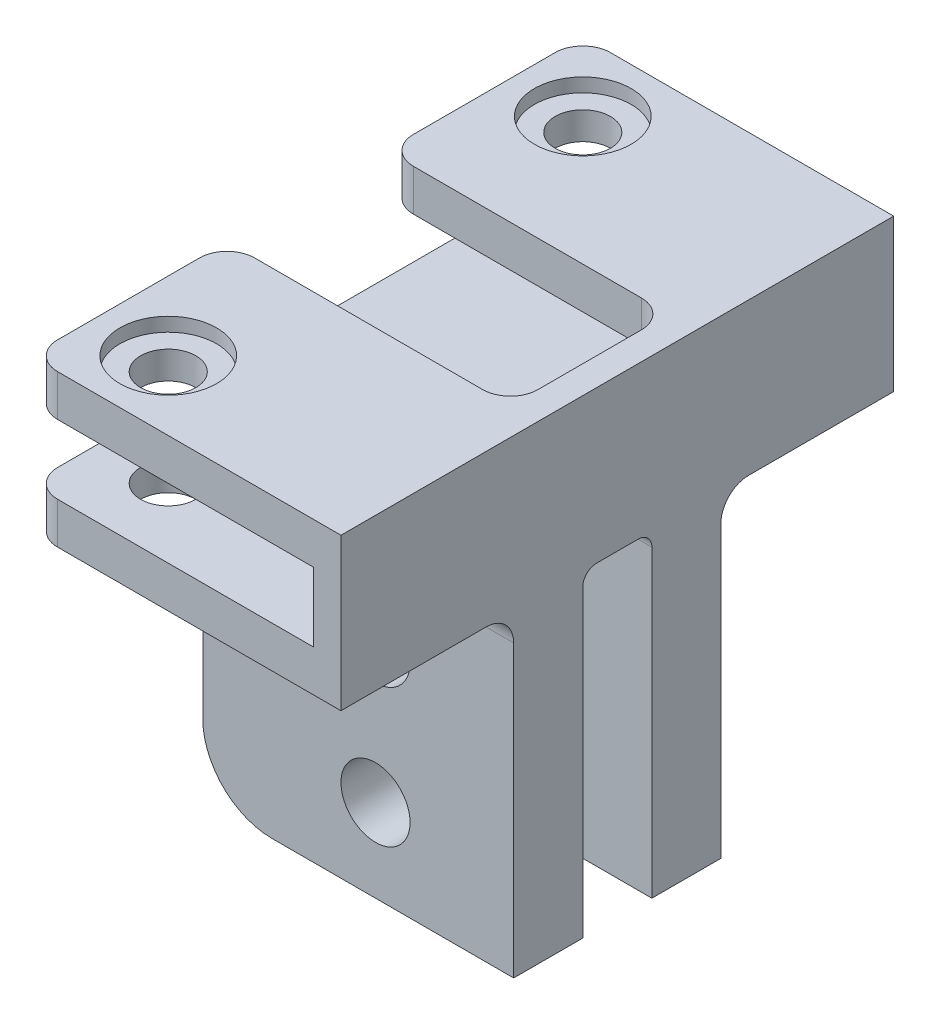
from build123d import *

# Parameters (mm, degrees)
SKETCH2_W            = 10
SKETCH2_H            = 21
SKETCH2_R            = 2.5
BOSS_EXTRUDE1_DEPTH  = 5
BOSS_EXTRUDE3_START  = 5
SKETCH3_W            = 10
SKETCH3_H            = 21
SKETCH3_R            = 2.5
BOSS_EXTRUDE3_DEPTH  = 5
SKETCH4_W            = 10
SKETCH4_H            = 5
BOSS_EXTRUDE4_DEPTH  = 2
SKETCH5_W            = 10
SKETCH5_H            = 5
BOSS_EXTRUDE5_DEPTH  = 2
BOSS_EXTRUDE6_DEPTH  = 3
FILLET1_R            = 1
FILLET2_R            = 2
BOSS_EXTRUDE7_DEPTH  = 5
SKETCH9_W            = 2
SKETCH9_H            = 40
BOSS_EXTRUDE8_DEPTH  = 5
SKETCH10_W           = 15
SKETCH10_H           = 40
BOSS_EXTRUDE9_DEPTH  = 3
CUT_EXTRUDE1_DEPTH   = 3
SKETCH13_W           = 14.256248666
SKETCH13_H           = 3
BOSS_EXTRUDE10_DEPTH = 7.5
SKETCH14_R           = 2
CUT_EXTRUDE2_DEPTH   = 44.44249072
SKETCH15_R           = 3.5
CUT_EXTRUDE3_DEPTH   = 1
CUT_EXTRUDE4_DEPTH   = 1
CUT_EXTRUDE5_DEPTH   = 1
FILLET3_R            = 5
FILLET4_R            = 2
FILLET5_R            = 2


with BuildPart() as part:
    # Sketch2 → Boss-Extrude1 (new body)
    with BuildSketch(Plane.XY):
        with Locations((5, 41.5)):
            Rectangle(SKETCH2_W, SKETCH2_H)
        with Locations((5, 47)):
            Circle(SKETCH2_R, mode=Mode.SUBTRACT)
        with Locations((5, 37)):
            Circle(SKETCH2_R, mode=Mode.SUBTRACT)
    extrude(amount=BOSS_EXTRUDE1_DEPTH)

    # Sketch4 → Boss-Extrude4 (add)
    with BuildSketch(Plane(origin=(0, 52, 0), x_dir=(1, 0, 0), z_dir=(0, 1, 0))):
        with Locations((5, -2.5)):
            Rectangle(SKETCH4_W, SKETCH4_H)
    extrude(amount=BOSS_EXTRUDE4_DEPTH)



with BuildPart() as body_2:
    # Sketch3 → Boss-Extrude3 (new body)
    with BuildSketch(Plane(origin=(0, 0, 0), x_dir=(-1, 0, 0), z_dir=(0, 0, -1)).offset(BOSS_EXTRUDE3_START)):
        with Locations((-5, 41.5)):
            Rectangle(SKETCH3_W, SKETCH3_H)
        with Locations(Location((-5, 37, 0), (0, 0, 180))):
            Circle(SKETCH3_R, mode=Mode.SUBTRACT)
        with Locations(Location((-5, 47, 0), (0, 0, 180))):
            Circle(SKETCH3_R, mode=Mode.SUBTRACT)
    extrude(amount=BOSS_EXTRUDE3_DEPTH)

    # Sketch5 → Boss-Extrude5 (add)
    with BuildSketch(Plane(origin=(0, 52, 0), x_dir=(1, 0, 0), z_dir=(0, 1, 0))):
        with Locations((5, 7.5)):
            Rectangle(SKETCH5_W, SKETCH5_H)
    extrude(amount=BOSS_EXTRUDE5_DEPTH)


with BuildPart() as part_1:
    add(part.part)

    add(body_2.part)  # Boss-Extrude6 merges body 2
    # Sketch6 → Boss-Extrude6 (add)
    with BuildSketch(Plane(origin=(0, 54, 0), x_dir=(1, 0, 0), z_dir=(0, 1, 0))):
        Polygon((10, -5), (10, -17.5), (0, -17.5), (0, -5), (0, 10), (0, 22.5), (10, 22.5), (10, 10), align=None)
    extrude(amount=BOSS_EXTRUDE6_DEPTH)

    # Fillet1
    fillet1_edges = [part_1.edges().sort_by_distance(p)[0] for p in [
        (5, 54, 0),
        (5, 54, -5),
    ]]
    fillet(fillet1_edges, radius=FILLET1_R)

    # Fillet2
    fillet2_edges = [part_1.edges().sort_by_distance(p)[0] for p in [
        (5, 54, 5),
        (5, 54, -10),
    ]]
    fillet(fillet2_edges, radius=FILLET2_R)

    # Sketch8 → Boss-Extrude7 (add)
    with BuildSketch(Plane(origin=(10, 0, 0), x_dir=(0, 0, -1), z_dir=(1, 0, 0))):
        with BuildLine():
            Line((0, 31), (0, 53))
            ThreePointArc((0, 53), (0.292893219, 53.707106781), (1, 54))
            Line((1, 54), (4, 54))
            ThreePointArc((4, 54), (4.707106781, 53.707106781), (5, 53))
            Line((5, 53), (5, 31))
            Line((5, 31), (10, 31))
            Line((10, 31), (10, 52))
            ThreePointArc((10, 52), (10.585786438, 53.414213562), (12, 54))
            Line((12, 54), (22.5, 54))
            Line((22.5, 54), (22.5, 57))
            Line((22.5, 57), (-17.5, 57))
            Line((-17.5, 57), (-17.5, 54))
            Line((-17.5, 54), (-7, 54))
            ThreePointArc((-7, 54), (-5.585786438, 53.414213562), (-5, 52))
            Line((-5, 52), (-5, 31))
            Line((-5, 31), (0, 31))
        make_face()
    extrude(amount=BOSS_EXTRUDE7_DEPTH)

    # Sketch9 → Boss-Extrude8 (add)
    with BuildSketch(Plane(origin=(0, 57, 0), x_dir=(1, 0, 0), z_dir=(0, 1, 0))):
        with Locations((14, 2.5)):
            Rectangle(SKETCH9_W, SKETCH9_H)
    extrude(amount=BOSS_EXTRUDE8_DEPTH)

    # Sketch10 → Boss-Extrude9 (add)
    with BuildSketch(Plane(origin=(0, 62, 0), x_dir=(1, 0, 0), z_dir=(0, 1, 0))):
        with Locations((7.5, 2.5)):
            Rectangle(SKETCH10_W, SKETCH10_H)
    extrude(amount=BOSS_EXTRUDE9_DEPTH)

    # Sketch12 → Cut-Extrude1 (cut)
    with BuildSketch(Plane(origin=(0, 65, 0), x_dir=(1, 0, 0), z_dir=(0, 1, 0))):
        Polygon((13, 8.243751334), (2, 8.243751334), (0, 8.243751334), (0, -3.243751334), (2, -3.243751334), (13, -3.243751334), align=None)
    extrude(amount=-CUT_EXTRUDE1_DEPTH, mode=Mode.SUBTRACT)

    # Sketch13 → Boss-Extrude10 (add)
    with BuildSketch(Plane.ZY):
        with Locations((10.371875667, 63.5)):
            Rectangle(SKETCH13_W, SKETCH13_H)
        with BuildLine():
            Line((-4, 54), (-1, 54))
            ThreePointArc((-1, 54), (-0.292893219, 53.707106781), (0, 53))
            Line((0, 53), (0, 31))
            Line((0, 31), (5, 31))
            Line((5, 31), (5, 52))
            ThreePointArc((5, 52), (5.585786438, 53.414213562), (7, 54))
            Line((7, 54), (17.5, 54))
            Line((17.5, 54), (17.5, 57))
            Line((17.5, 57), (-22.5, 57))
            Line((-22.5, 57), (-22.5, 54))
            Line((-22.5, 54), (-12, 54))
            ThreePointArc((-12, 54), (-10.585786438, 53.414213562), (-10, 52))
            Line((-10, 52), (-10, 31))
            Line((-10, 31), (-5, 31))
            Line((-5, 31), (-5, 53))
            ThreePointArc((-5, 53), (-4.707106781, 53.707106781), (-4, 54))
        make_face()
        with Locations((-15.371875667, 63.5)):
            Rectangle(SKETCH13_W, SKETCH13_H)
    extrude(amount=BOSS_EXTRUDE10_DEPTH)

    # Sketch14 → Cut-Extrude2 (cut, through all)
    with BuildSketch(Plane(origin=(0, 65, 0), x_dir=(1, 0, 0), z_dir=(0, 1, 0))):
        with Locations(Location((-2.5, -12.5, 0), (0, 0, 270))):
            Circle(SKETCH14_R)
        with Locations(Location((-2.5, 17.5, 0), (0, 0, 270))):
            Circle(SKETCH14_R)
    extrude(amount=-CUT_EXTRUDE2_DEPTH, mode=Mode.SUBTRACT)

    # Sketch15 → Cut-Extrude3 (cut)
    with BuildSketch(Plane(origin=(0, 65, 0), x_dir=(1, 0, 0), z_dir=(0, 1, 0))):
        with Locations(Location((-2.5, 17.5, 0), (0, 0, 270))):
            Circle(SKETCH15_R)
        with Locations(Location((-2.5, -12.5, 0), (0, 0, 270))):
            Circle(SKETCH15_R)
    extrude(amount=-CUT_EXTRUDE3_DEPTH, mode=Mode.SUBTRACT)

    # Sketch16 → Cut-Extrude4 (cut)
    with BuildSketch(Plane.XZ.offset(-54)):
        Polygon((-6.75, 14.953738644), (-6.75, 10.046261356), (-2.5, 7.592522712), (1.75, 10.046261356), (1.75, 14.953738644), (-2.5, 17.407477288), align=None)
    extrude(amount=-CUT_EXTRUDE4_DEPTH, mode=Mode.SUBTRACT)

    # Sketch17 → Cut-Extrude5 (cut)
    with BuildSketch(Plane(origin=(0, 54, 0), x_dir=(-1, 0, 0), z_dir=(0, -1, 0))):
        Polygon((6.75, 15.046261356), (6.75, 19.953738644), (2.5, 22.407477288), (-1.75, 19.953738644), (-1.75, 15.046261356), (2.5, 12.592522712), align=None)
    extrude(amount=-CUT_EXTRUDE5_DEPTH, mode=Mode.SUBTRACT)

    # Fillet3
    fillet3_edges = [part_1.edges().sort_by_distance(p)[0] for p in [
        (-7.5, 31, 2.5),
        (-7.5, 31, -7.5),
    ]]
    fillet(fillet3_edges, radius=FILLET3_R)

    # Fillet4
    fillet4_edges = [part_1.edges().sort_by_distance(p)[0] for p in [
        (-7.5, 55.5, 17.5),
        (-7.5, 55.5, -22.5),
        (-7.5, 63.5, 17.5),
        (-7.5, 63.5, 3.243751334),
        (-7.5, 63.5, -22.5),
        (-7.5, 63.5, -8.243751334),
    ]]
    fillet(fillet4_edges, radius=FILLET4_R)

    # Fillet5
    fillet5_edges = [part_1.edges().sort_by_distance(p)[0] for p in [
        (13, 63.5, -8.243751334),
        (13, 63.5, 3.243751334),
    ]]
    fillet(fillet5_edges, radius=FILLET5_R)


solid = part_1.part
